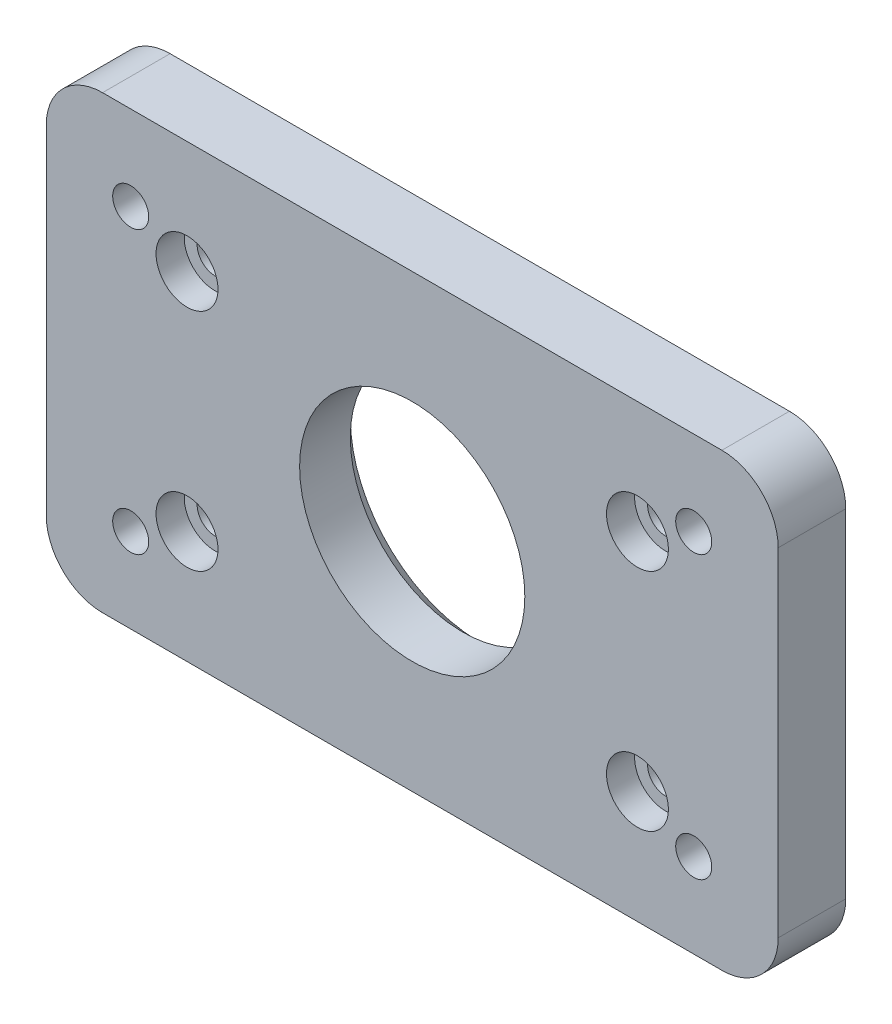
from build123d import *

# Parameters (mm, degrees)
SKETCH_1_R          = 3.2
SKETCH_1_R_2        = 20
EXTRUDE_1_DEPTH     = 12
FILLET_1_R          = 10
CHAMFER_1_SIZE      = 3
SKETCH_2_R          = 5.5
CUT_EXTRUDE_1_DEPTH = 5


with BuildPart() as part:
    # 草图1 → 凸台-拉伸1 (new body)
    with BuildSketch(Plane.XY):
        Polygon((50, 40), (-50, 40), (-65, 40), (-65, -40), (-50, -40), (50, -40), (65, -40), (65, 40), align=None)
        with Locations((-50, -25)):
            Circle(SKETCH_1_R, mode=Mode.SUBTRACT)
        with Locations((-40, -20)):
            Circle(SKETCH_1_R, mode=Mode.SUBTRACT)
        with Locations((40, -20)):
            Circle(SKETCH_1_R, mode=Mode.SUBTRACT)
        with Locations((50, -25)):
            Circle(SKETCH_1_R, mode=Mode.SUBTRACT)
        with Locations((-50, 25)):
            Circle(SKETCH_1_R, mode=Mode.SUBTRACT)
        with Locations((-40, 20)):
            Circle(SKETCH_1_R, mode=Mode.SUBTRACT)
        Circle(SKETCH_1_R_2, mode=Mode.SUBTRACT)
        with Locations((40, 20)):
            Circle(SKETCH_1_R, mode=Mode.SUBTRACT)
        with Locations((50, 25)):
            Circle(SKETCH_1_R, mode=Mode.SUBTRACT)
    extrude(amount=EXTRUDE_1_DEPTH)

    # 圆角1
    fillet_1_edges = [part.edges().sort_by_distance(p)[0] for p in [
        (-65, -40, 6),
        (-65, 40, 6),
        (65, 40, 6),
        (65, -40, 6),
    ]]
    fillet(fillet_1_edges, radius=FILLET_1_R)

    # 倒角1
    chamfer_1_edges = [part.edges().sort_by_distance(p)[0] for p in [
        (-20, 0, 0),
    ]]
    chamfer(chamfer_1_edges, length=CHAMFER_1_SIZE)

    # 草图2 → 切除-拉伸1 (cut)
    with BuildSketch(Plane.XY.offset(12)):
        with Locations((-40, 20)):
            Circle(SKETCH_2_R)
        with Locations((-40, -20)):
            Circle(SKETCH_2_R)
        with Locations((40, 20)):
            Circle(SKETCH_2_R)
        with Locations((40, -20)):
            Circle(SKETCH_2_R)
    extrude(amount=-CUT_EXTRUDE_1_DEPTH, mode=Mode.SUBTRACT)


solid = part.part
